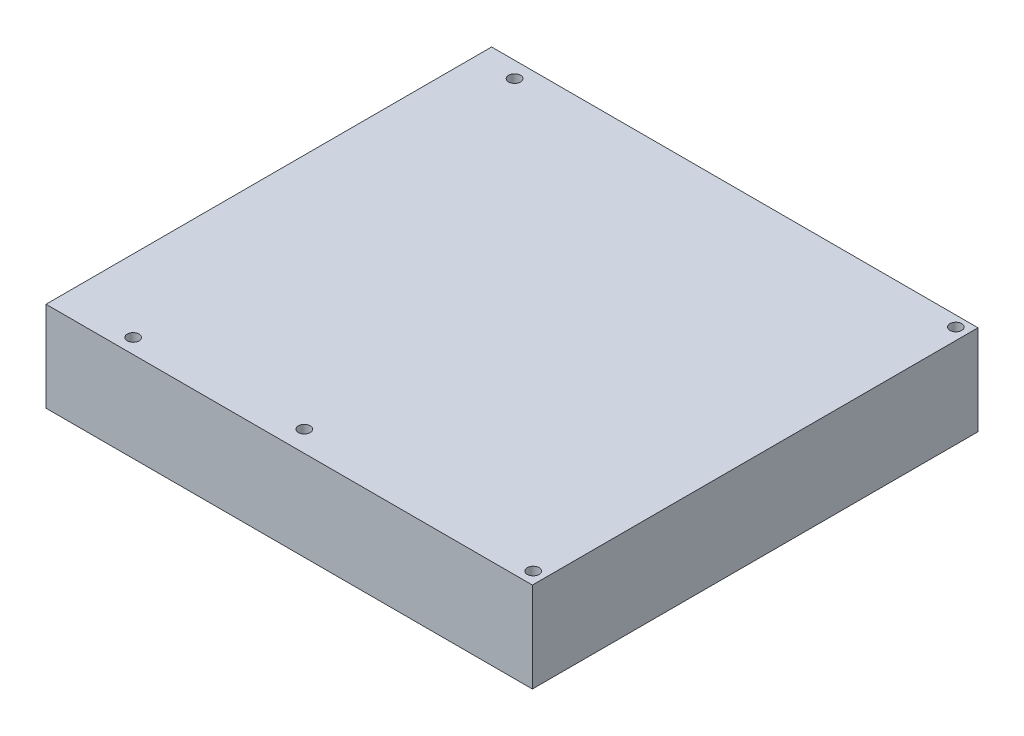
from build123d import *

# Parameters (mm, degrees)
ESQUISSE1_W             = 102.6
ESQUISSE1_H             = 94
BOSS_EXTRU_1_DEPTH      = 19
ESQUISSE2_R             = 1.25
ENL_V_MAT_EXTRU_1_DEPTH = 141.441304466


with BuildPart() as part:
    # Esquisse1 → Boss.-Extru.1 (new body)
    with BuildSketch(Plane(origin=(0, 0, 0), x_dir=(1, 0, 0), z_dir=(0, 1, 0))):
        with Locations((51.3, 47)):
            Rectangle(ESQUISSE1_W, ESQUISSE1_H)
    extrude(amount=BOSS_EXTRU_1_DEPTH)

    # Esquisse2 → Enlèv. mat.-Extru.1 (cut, through all)
    with BuildSketch(Plane(origin=(0, 19, 0), x_dir=(1, 0, 0), z_dir=(0, 1, 0))):
        with Locations(Location((8.19879565, 90.638127074, 0), (0, 0, 270))):
            Circle(ESQUISSE2_R)
        with Locations(Location((100.126132376, 91.799894843, 0), (0, 0, 270))):
            Circle(ESQUISSE2_R)
        with Locations(Location((100.126132376, 2.640418581, 0), (0, 0, 270))):
            Circle(ESQUISSE2_R)
        with Locations(Location((50.06348936, 4.422062011, 0), (0, 0, 270))):
            Circle(ESQUISSE2_R)
        with Locations(Location((15.259017819, 3.122110717, 0), (0, 0, 270))):
            Circle(ESQUISSE2_R)
    extrude(amount=-ENL_V_MAT_EXTRU_1_DEPTH, mode=Mode.SUBTRACT)


solid = part.part
